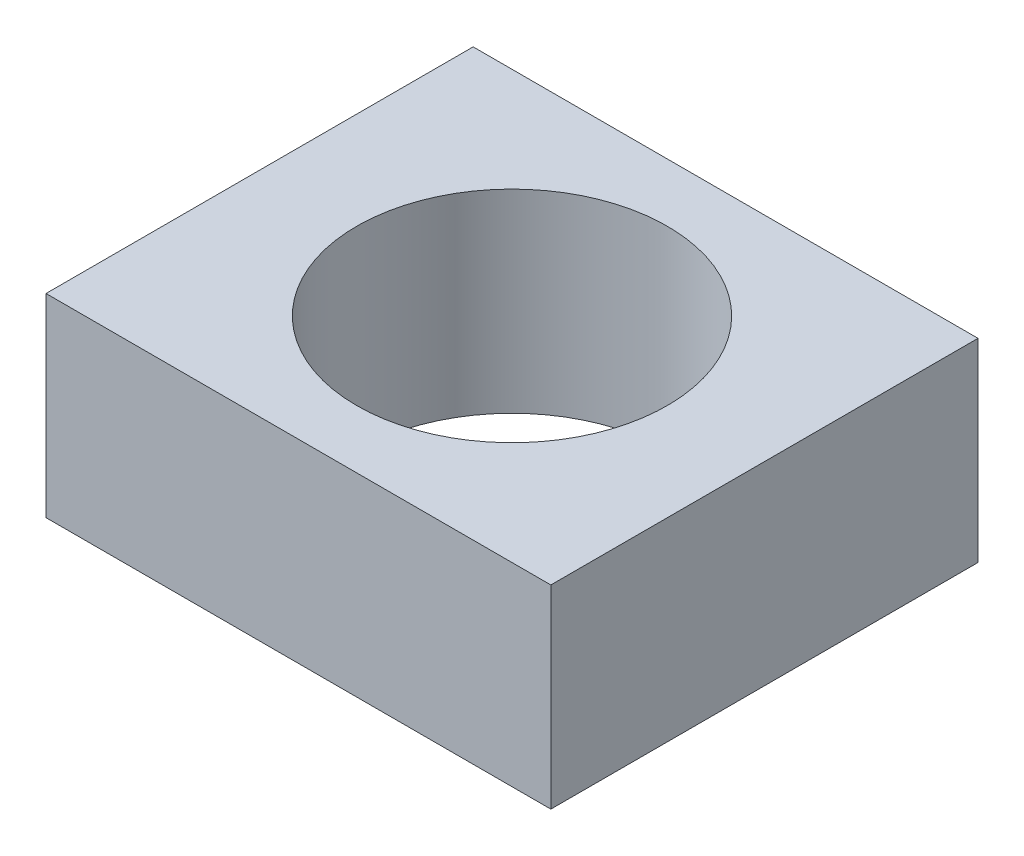
from build123d import *

# Parameters (mm, degrees)
SKETCH2_W           = 13
SKETCH2_H           = 11
BOSS_EXTRUDE2_DEPTH = 5
SKETCH3_R           = 4
CUT_EXTRUDE1_DEPTH  = 5


with BuildPart() as part:
    # Sketch2 → Boss-Extrude2 (new body)
    with BuildSketch(Plane(origin=(0, 0, 0), x_dir=(1, 0, 0), z_dir=(0, 1, 0))):
        Rectangle(SKETCH2_W, SKETCH2_H)
    extrude(amount=BOSS_EXTRUDE2_DEPTH)

    # Sketch3 → Cut-Extrude1 (cut)
    with BuildSketch(Plane(origin=(0, 5, 0), x_dir=(1, 0, 0), z_dir=(0, 1, 0))):
        with Locations(Location((0, 0, 0), (0, 0, 270))):
            Circle(SKETCH3_R)
    extrude(amount=-CUT_EXTRUDE1_DEPTH, mode=Mode.SUBTRACT)


solid = part.part
